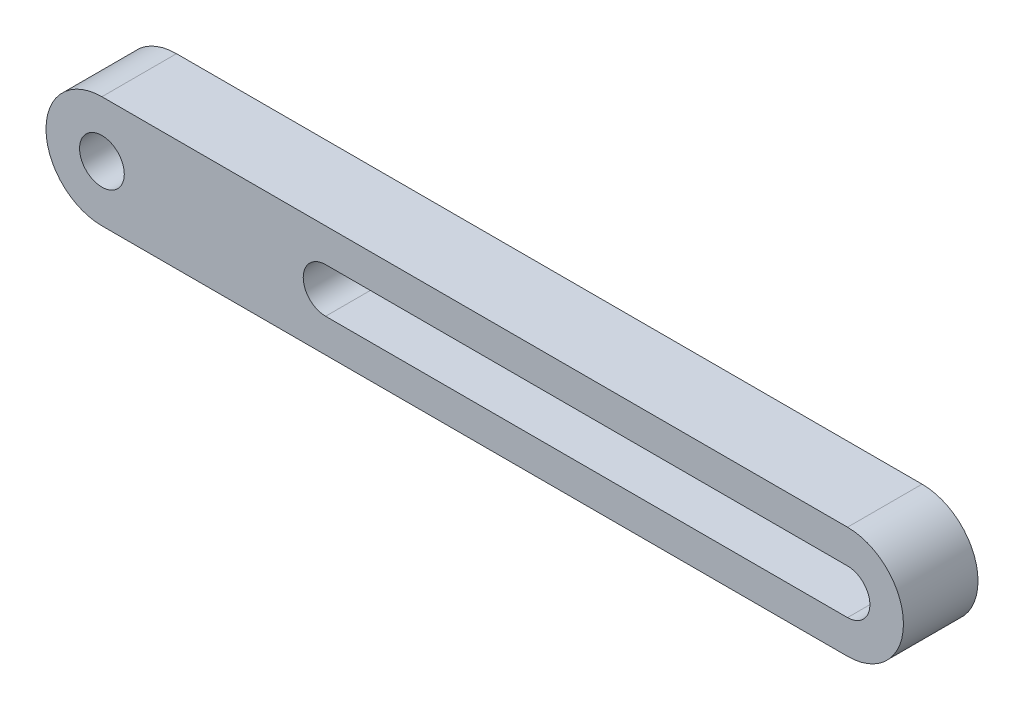
from build123d import *

# Parameters (mm, degrees)
CROQUIS1_R              = 1.5
SALIENTE_EXTRUIR1_DEPTH = 5


with BuildPart() as part:
    # Croquis1 → Saliente-Extruir1 (new body)
    with BuildSketch(Plane.XY):
        with BuildLine():
            Line((0, 3.75), (50, 3.75))
            ThreePointArc((50, 3.75), (53.75, 0), (50, -3.75))
            Line((50, -3.75), (0, -3.75))
            ThreePointArc((0, -3.75), (-3.75, 0), (0, 3.75))
        make_face()
        Circle(CROQUIS1_R, mode=Mode.SUBTRACT)
        with BuildLine():
            Line((15, 1.5), (50, 1.5))
            ThreePointArc((50, 1.5), (51.5, 0), (50, -1.5))
            Line((50, -1.5), (15, -1.5))
            ThreePointArc((15, -1.5), (13.5, 0), (15, 1.5))
        make_face(mode=Mode.SUBTRACT)
    extrude(amount=SALIENTE_EXTRUIR1_DEPTH)


solid = part.part
